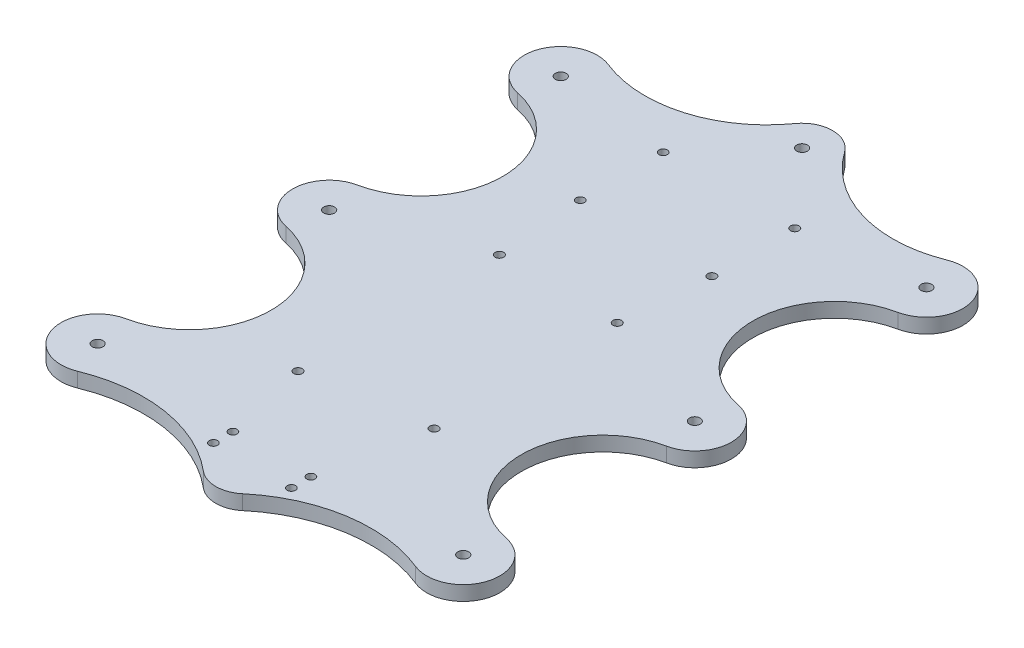
from build123d import *

# Parameters (mm, degrees)
BOSS_EXTRUDE1_DEPTH = 6
SKETCH2_R           = 2.2
CUT_EXTRUDE1_DEPTH  = 235.538376391
CUT_EXTRUDE2_REACH  = 236.538
SKETCH3_R           = 1.7
CUT_EXTRUDE4_REACH  = 236.538
SKETCH5_R           = 2.2
CUT_EXTRUDE5_REACH  = 236.538
SKETCH6_R           = 1.7
SKETCH6_R_2         = 1.75
CUT_EXTRUDE6_REACH  = 236.538
SKETCH7_R           = 1.75


with BuildPart() as part:
    # Sketch1 → Boss-Extrude1 (new body)
    with BuildSketch(Plane(origin=(0, 0, 0), x_dir=(1, 0, 0), z_dir=(0, 1, 0))):
        with BuildLine():
            ThreePointArc((-69.425886336, 13.925848515), (-89.364705834, 4.31916963), (-78.030296498, -14.690721668))
            ThreePointArc((-78.030296498, -14.690721668), (-51.297958971, -47.499999875), (-78.030296252, -80.309278281))
            ThreePointArc((-78.030296252, -80.309278281), (-90, -94.999999814), (-78.030296616, -109.690721644))
            ThreePointArc((-78.030296616, -109.690721644), (-51.297958971, -142.5), (-78.030296616, -175.309278356))
            ThreePointArc((-78.030296616, -175.309278356), (-89.351304792, -194.363490663), (-69.340019232, -203.891170494))
            ThreePointArc((-69.340019232, -203.891170494), (-37.34886135, -200.189043247), (-8.051740928, -213.561352835))
            ThreePointArc((-8.051740928, -213.561352835), (-6.73e-07, -216.5), (8.051739898, -213.561353702))
            ThreePointArc((8.051739898, -213.561353702), (37.348860289, -200.189043415), (69.340018489, -203.891170192))
            ThreePointArc((69.340018489, -203.891170192), (89.351304588, -194.363491335), (78.030297206, -175.309278478))
            ThreePointArc((78.030297206, -175.309278478), (51.297958971, -142.500000301), (78.030296616, -109.690721644))
            ThreePointArc((78.030296616, -109.690721644), (90, -95.000000257), (78.03029712, -80.30927846))
            ThreePointArc((78.03029712, -80.30927846), (51.297958971, -47.500000257), (78.030296616, -14.690721644))
            ThreePointArc((78.030296616, -14.690721644), (89.364705852, 4.319169572), (69.425886562, 13.925848605))
            ThreePointArc((69.425886562, 13.925848605), (36.800743446, 12.358424364), (10.169102241, 31.26906869))
            ThreePointArc((10.169102241, 31.26906869), (2.26e-07, 36.5), (-10.169101978, 31.269069058))
            ThreePointArc((-10.169101978, 31.269069058), (-36.800743112, 12.358424462), (-69.425886336, 13.925848515))
        make_face()
    extrude(amount=BOSS_EXTRUDE1_DEPTH)

    # Sketch2 → Cut-Extrude1 (cut, through all)
    with BuildSketch(Plane.XZ):
        with Locations(Location((-75, 190, 0), (0, 0, 270))):
            Circle(SKETCH2_R)
        with Locations(Location((-75, 95, 0), (0, 0, 270))):
            Circle(SKETCH2_R)
        with Locations(Location((-75, 0, 0), (0, 0, 270))):
            Circle(SKETCH2_R)
        with Locations(Location((75, 0, 0), (0, 0, 270))):
            Circle(SKETCH2_R)
        with Locations(Location((75, 95, 0), (0, 0, 270))):
            Circle(SKETCH2_R)
        with Locations(Location((75, 190, 0), (0, 0, 270))):
            Circle(SKETCH2_R)
    extrude(amount=-CUT_EXTRUDE1_DEPTH, mode=Mode.SUBTRACT)

    # Sketch3 → Cut-Extrude2 (cut, up to next)
    with BuildSketch(Plane(origin=(0, 6, 0), x_dir=(1, 0, 0), z_dir=(0, 1, 0)), mode=Mode.PRIVATE) as cut_extrude2_sk1:
        with Locations(Location((-16, -193.5, 0), (0, 0, 270))):
            Circle(SKETCH3_R)
    cut_extrude2_tool1 = extrude(cut_extrude2_sk1.sketch, amount=-CUT_EXTRUDE2_REACH, mode=Mode.PRIVATE) & part.part
    # Sketch3 → Cut-Extrude2 (cut, up to next)
    with BuildSketch(Plane(origin=(0, 6, 0), x_dir=(1, 0, 0), z_dir=(0, 1, 0)), mode=Mode.PRIVATE) as cut_extrude2_sk2:
        with Locations(Location((16, -193.5, 0), (0, 0, 270))):
            Circle(SKETCH3_R)
    cut_extrude2_tool2 = extrude(cut_extrude2_sk2.sketch, amount=-CUT_EXTRUDE2_REACH, mode=Mode.PRIVATE) & part.part
    # Sketch3 → Cut-Extrude2 (cut, up to next)
    with BuildSketch(Plane(origin=(0, 6, 0), x_dir=(1, 0, 0), z_dir=(0, 1, 0)), mode=Mode.PRIVATE) as cut_extrude2_sk3:
        with Locations(Location((-16, -201.5, 0), (0, 0, 270))):
            Circle(SKETCH3_R)
    cut_extrude2_tool3 = extrude(cut_extrude2_sk3.sketch, amount=-CUT_EXTRUDE2_REACH, mode=Mode.PRIVATE) & part.part
    # Sketch3 → Cut-Extrude2 (cut, up to next)
    with BuildSketch(Plane(origin=(0, 6, 0), x_dir=(1, 0, 0), z_dir=(0, 1, 0)), mode=Mode.PRIVATE) as cut_extrude2_sk4:
        with Locations(Location((16, -201.5, 0), (0, 0, 270))):
            Circle(SKETCH3_R)
    cut_extrude2_tool4 = extrude(cut_extrude2_sk4.sketch, amount=-CUT_EXTRUDE2_REACH, mode=Mode.PRIVATE) & part.part
    add(cut_extrude2_tool1.solids().sort_by_distance((-16, 6, 193.5))[0], mode=Mode.SUBTRACT)
    add(cut_extrude2_tool2.solids().sort_by_distance((16, 6, 193.5))[0], mode=Mode.SUBTRACT)
    add(cut_extrude2_tool3.solids().sort_by_distance((-16, 6, 201.5))[0], mode=Mode.SUBTRACT)
    add(cut_extrude2_tool4.solids().sort_by_distance((16, 6, 201.5))[0], mode=Mode.SUBTRACT)

    # Sketch5 → Cut-Extrude4 (cut, up to next)
    with BuildSketch(Plane(origin=(0, 6, 0), x_dir=(1, 0, 0), z_dir=(0, 1, 0)), mode=Mode.PRIVATE) as cut_extrude4_sk1:
        with Locations(Location((0, 24, 0), (0, 0, 270))):
            Circle(SKETCH5_R)
    cut_extrude4_tool1 = extrude(cut_extrude4_sk1.sketch, amount=-CUT_EXTRUDE4_REACH, mode=Mode.PRIVATE) & part.part
    add(cut_extrude4_tool1.solids().sort_by_distance((0, 6, -24))[0], mode=Mode.SUBTRACT)

    # Sketch6 → Cut-Extrude5 (cut, up to next)
    with BuildSketch(Plane(origin=(0, 6, 0), x_dir=(1, 0, 0), z_dir=(0, 1, 0)), mode=Mode.PRIVATE) as cut_extrude5_sk1:
        with Locations(Location((-27, -6, 0), (0, 0, 270))):
            Circle(SKETCH6_R)
    cut_extrude5_tool1 = extrude(cut_extrude5_sk1.sketch, amount=-CUT_EXTRUDE5_REACH, mode=Mode.PRIVATE) & part.part
    # Sketch6 → Cut-Extrude5 (cut, up to next)
    with BuildSketch(Plane(origin=(0, 6, 0), x_dir=(1, 0, 0), z_dir=(0, 1, 0)), mode=Mode.PRIVATE) as cut_extrude5_sk2:
        with Locations(Location((27, -6, 0), (0, 0, 270))):
            Circle(SKETCH6_R_2)
    cut_extrude5_tool2 = extrude(cut_extrude5_sk2.sketch, amount=-CUT_EXTRUDE5_REACH, mode=Mode.PRIVATE) & part.part
    # Sketch6 → Cut-Extrude5 (cut, up to next)
    with BuildSketch(Plane(origin=(0, 6, 0), x_dir=(1, 0, 0), z_dir=(0, 1, 0)), mode=Mode.PRIVATE) as cut_extrude5_sk3:
        with Locations(Location((-27, -40, 0), (0, 0, 270))):
            Circle(SKETCH6_R)
    cut_extrude5_tool3 = extrude(cut_extrude5_sk3.sketch, amount=-CUT_EXTRUDE5_REACH, mode=Mode.PRIVATE) & part.part
    # Sketch6 → Cut-Extrude5 (cut, up to next)
    with BuildSketch(Plane(origin=(0, 6, 0), x_dir=(1, 0, 0), z_dir=(0, 1, 0)), mode=Mode.PRIVATE) as cut_extrude5_sk4:
        with Locations(Location((27, -40, 0), (0, 0, 270))):
            Circle(SKETCH6_R_2)
    cut_extrude5_tool4 = extrude(cut_extrude5_sk4.sketch, amount=-CUT_EXTRUDE5_REACH, mode=Mode.PRIVATE) & part.part
    add(cut_extrude5_tool1.solids().sort_by_distance((-27, 6, 6))[0], mode=Mode.SUBTRACT)
    add(cut_extrude5_tool2.solids().sort_by_distance((27, 6, 6))[0], mode=Mode.SUBTRACT)
    add(cut_extrude5_tool3.solids().sort_by_distance((-27, 6, 40))[0], mode=Mode.SUBTRACT)
    add(cut_extrude5_tool4.solids().sort_by_distance((27, 6, 40))[0], mode=Mode.SUBTRACT)

    # Sketch7 → Cut-Extrude6 (cut, up to next)
    with BuildSketch(Plane(origin=(0, 6, 0), x_dir=(1, 0, 0), z_dir=(0, 1, 0)), mode=Mode.PRIVATE) as cut_extrude6_sk1:
        with Locations(Location((-24.17, -76, 0), (0, 0, 270))):
            Circle(SKETCH7_R)
    cut_extrude6_tool1 = extrude(cut_extrude6_sk1.sketch, amount=-CUT_EXTRUDE6_REACH, mode=Mode.PRIVATE) & part.part
    # Sketch7 → Cut-Extrude6 (cut, up to next)
    with BuildSketch(Plane(origin=(0, 6, 0), x_dir=(1, 0, 0), z_dir=(0, 1, 0)), mode=Mode.PRIVATE) as cut_extrude6_sk2:
        with Locations(Location((24.17, -76, 0), (0, 0, 270))):
            Circle(SKETCH7_R)
    cut_extrude6_tool2 = extrude(cut_extrude6_sk2.sketch, amount=-CUT_EXTRUDE6_REACH, mode=Mode.PRIVATE) & part.part
    # Sketch7 → Cut-Extrude6 (cut, up to next)
    with BuildSketch(Plane(origin=(0, 6, 0), x_dir=(1, 0, 0), z_dir=(0, 1, 0)), mode=Mode.PRIVATE) as cut_extrude6_sk3:
        with Locations(Location((-24.17, -158.63, 0), (0, 0, 270))):
            Circle(SKETCH7_R)
    cut_extrude6_tool3 = extrude(cut_extrude6_sk3.sketch, amount=-CUT_EXTRUDE6_REACH, mode=Mode.PRIVATE) & part.part
    # Sketch7 → Cut-Extrude6 (cut, up to next)
    with BuildSketch(Plane(origin=(0, 6, 0), x_dir=(1, 0, 0), z_dir=(0, 1, 0)), mode=Mode.PRIVATE) as cut_extrude6_sk4:
        with Locations(Location((24.17, -151.13, 0), (0, 0, 270))):
            Circle(SKETCH7_R)
    cut_extrude6_tool4 = extrude(cut_extrude6_sk4.sketch, amount=-CUT_EXTRUDE6_REACH, mode=Mode.PRIVATE) & part.part
    add(cut_extrude6_tool1.solids().sort_by_distance((-24.17, 6, 76))[0], mode=Mode.SUBTRACT)
    add(cut_extrude6_tool2.solids().sort_by_distance((24.17, 6, 76))[0], mode=Mode.SUBTRACT)
    add(cut_extrude6_tool3.solids().sort_by_distance((-24.17, 6, 158.63))[0], mode=Mode.SUBTRACT)
    add(cut_extrude6_tool4.solids().sort_by_distance((24.17, 6, 151.13))[0], mode=Mode.SUBTRACT)


solid = part.part
